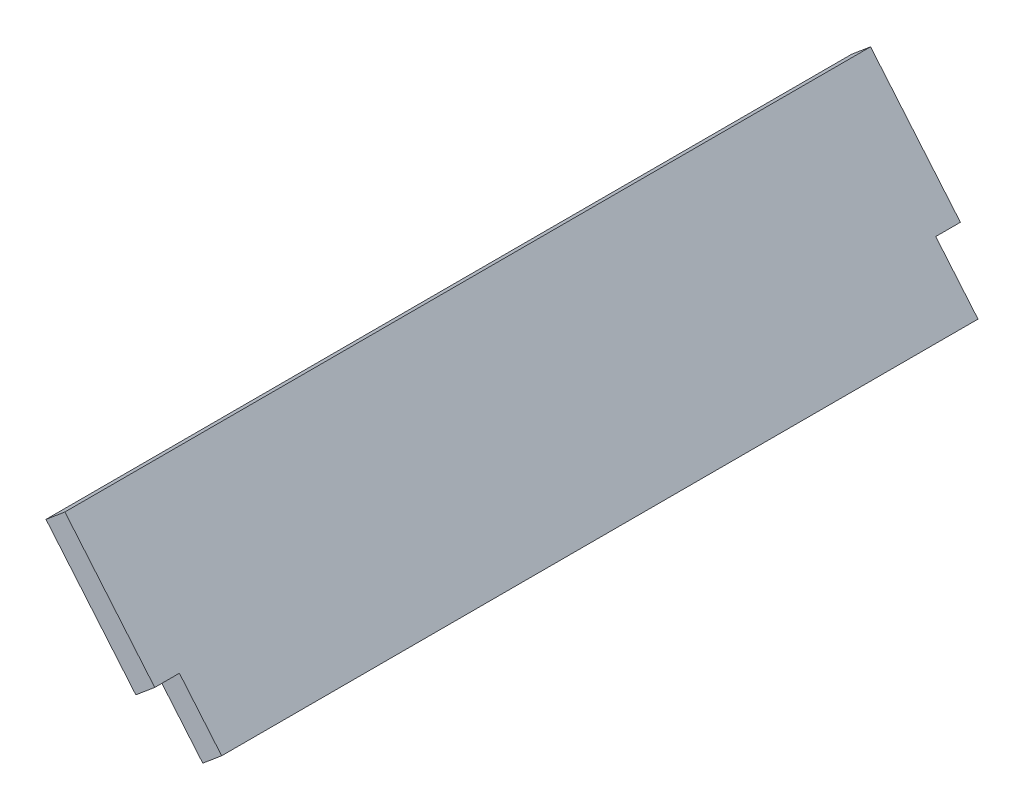
from build123d import *

# Parameters (mm, degrees)
SALIENTE_EXTRUIR1_DEPTH = 92
CROQUIS3_W              = 3
CROQUIS3_H              = 17
SALIENTE_EXTRUIR2_DEPTH = 3


with BuildPart() as part:
    # Croquis1 → Saliente-Extruir1 (new body)
    with BuildSketch(Plane.XY):
        Polygon((0, 0), (16.069690242, -19.151111078), (13.771556913, -21.079473907), (-2.298133329, -1.928362829), align=None)
    extrude(amount=SALIENTE_EXTRUIR1_DEPTH)

    # Croquis3 → Saliente-Extruir2 (add)
    with BuildSketch(Plane(origin=(-2.298133329, -1.928362829, 0), x_dir=(0, 0, 1), z_dir=(-0.7660444431189819, -0.6427876096865347, 0))):
        with Locations((93.5, -8.5)):
            Rectangle(CROQUIS3_W, CROQUIS3_H)
        with Locations((-1.5, -8.5)):
            Rectangle(CROQUIS3_W, CROQUIS3_H)
    extrude(amount=-SALIENTE_EXTRUIR2_DEPTH)


solid = part.part
